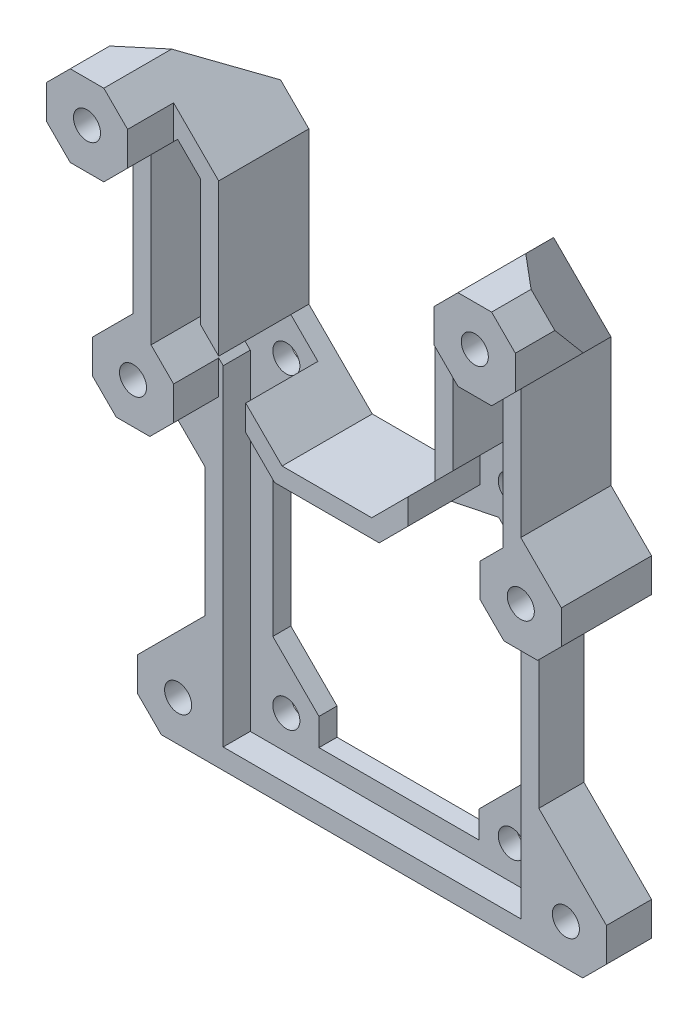
from build123d import *

# Parameters (mm, degrees)
SKETCH5_R           = 1.5
BOSS_EXTRUDE1_DEPTH = 2
SKETCH9_R           = 1.5
BOSS_EXTRUDE3_DEPTH = 3
SKETCH10_R          = 1.5
BOSS_EXTRUDE4_DEPTH = 5
BOSS_EXTRUDE5_DEPTH = 5.1
SKETCH13_R          = 1.5
CUT_EXTRUDE1_DEPTH  = 4.5
CUT_EXTRUDE2_DEPTH  = 7.5
CUT_EXTRUDE3_DEPTH  = 7.5
CHAMFER1_SIZE       = 1
CHAMFER1_SIZE2      = 1.191753593


with BuildPart() as part:
    # Sketch5 → Boss-Extrude1 (new body)
    with BuildSketch(Plane.XY):
        Polygon((19.636038969, -4.5), (-19.636038969, -4.5), (-23.363961031, -4.5), (-26, -1.863961031), (-26, 1.863961031), (-23.363961031, 4.5), (-18.5, 9.363961031), (-18.5, 23.636038969), (-23.363961031, 28.5), (-26, 31.136038969), (-26, 34.863961031), (-23.363961031, 37.5), (-21.5, 39.363961031), (-21.5, 53.636038969), (-23.363961031, 55.5), (-26, 58.136038969), (-26, 61.863961031), (-23.363961031, 64.5), (-19.636038969, 64.5), (-17, 61.863961031), (-12, 56.863961031), (-12, 40.029437252), (-11.050252532, 39.079689783), (-9, 37.029437252), (-4.970562748, 33), (4.970562748, 33), (9, 37.029437252), (11.050252532, 39.079689783), (12, 40.029437252), (12, 56.863961031), (17, 61.863961031), (19.636038969, 64.5), (23.363961031, 64.5), (26, 61.863961031), (26, 58.136038969), (23.363961031, 55.5), (21.5, 53.636038969), (21.5, 39.363961031), (23.363961031, 37.5), (26, 34.863961031), (26, 31.136038969), (23.363961031, 28.5), (18.5, 23.636038969), (18.5, 9.363961031), (23.363961031, 4.5), (26, 1.863961031), (26, -1.863961031), (23.363961031, -4.5), align=None)
        with Locations((-12.5, 35.579689783)):
            Circle(SKETCH5_R, mode=Mode.SUBTRACT)
        with Locations((-12.5, 1.5)):
            Circle(SKETCH5_R, mode=Mode.SUBTRACT)
        with Locations((12.5, 1.5)):
            Circle(SKETCH5_R, mode=Mode.SUBTRACT)
        with Locations((12.5, 35.579689783)):
            Circle(SKETCH5_R, mode=Mode.SUBTRACT)
        Polygon((-5.798989873, 31), (5.798989873, 31), (11.050252532, 32.079689783), (14, 29.129942315), (14, 8.121320344), (11, 5.121320344), (8.878679656, 3), (8.878679656, 0), (-8.878679656, 0), (-8.878679656, 3), (-11, 5.121320344), (-14, 8.121320344), (-14, 29.129942315), (-11.050252532, 32.079689783), align=None, mode=Mode.SUBTRACT)
    extrude(amount=BOSS_EXTRUDE1_DEPTH)

    # Sketch9 → Boss-Extrude3 (add)
    # profile 1 of 2: a face of its own
    with BuildSketch(Plane.XY.offset(2)):
        Polygon((19.636038969, -4.5), (-19.636038969, -4.5), (-23.363961031, -4.5), (-26, -1.863961031), (-26, 1.863961031), (-23.363961031, 4.5), (-18.5, 9.363961031), (-18.5, 23.636038969), (-23.363961031, 28.5), (-26, 31.136038969), (-26, 34.863961031), (-23.363961031, 37.5), (-21.5, 39.363961031), (-21.5, 53.636038969), (-23.363961031, 55.5), (-26, 58.136038969), (-26, 61.863961031), (-23.363961031, 64.5), (-19.636038969, 64.5), (-17, 61.863961031), (-12, 56.863961031), (-12, 40.029437252), (-14, 42.029437252), (-14, 56.035533906), (-16.550252532, 58.585786438), (-17, 58.136038969), (-19.5, 55.636038969), (-19.5, 37.363961031), (-17, 34.863961031), (-16.5, 34.363961031), (-16.5, -2.25), (16.5, -2.25), (16.5, 34.363961031), (17, 34.863961031), (19.5, 37.363961031), (19.5, 55.636038969), (17, 58.136038969), (16.550252532, 58.585786438), (14, 56.035533906), (14, 42.029437252), (12, 40.029437252), (12, 56.863961031), (17, 61.863961031), (19.636038969, 64.5), (23.363961031, 64.5), (26, 61.863961031), (26, 58.136038969), (23.363961031, 55.5), (21.5, 53.636038969), (21.5, 39.363961031), (23.363961031, 37.5), (26, 34.863961031), (26, 31.136038969), (23.363961031, 28.5), (18.5, 23.636038969), (18.5, 9.363961031), (23.363961031, 4.5), (26, 1.863961031), (26, -1.863961031), (23.363961031, -4.5), align=None)
        with Locations((-21.5, 0)):
            Circle(SKETCH9_R, mode=Mode.SUBTRACT)
        with Locations((-21.5, 33)):
            Circle(SKETCH9_R, mode=Mode.SUBTRACT)
        with Locations(Location((21.5, 33, 0), (0, 0, 180))):
            Circle(SKETCH9_R, mode=Mode.SUBTRACT)
        with Locations(Location((21.5, 0, 0), (0, 0, 180))):
            Circle(SKETCH9_R, mode=Mode.SUBTRACT)
    # profile 2 of 2: a face of its own
    with BuildSketch(Plane.XY.offset(2)):
        Polygon((4.970562748, 33), (-4.970562748, 33), (-9, 37.029437252), (-9, 34.201010127), (-5.798989873, 31), (5.798989873, 31), (9, 34.201010127), (9, 37.029437252), align=None)
    extrude(amount=BOSS_EXTRUDE3_DEPTH)

    # Sketch10 → Boss-Extrude4 (add)
    # profile 1 of 3: a face of its own
    with BuildSketch(Plane.XY.offset(5)):
        Polygon((-23.363961031, 28.5), (-19.636038969, 28.5), (-17, 31.136038969), (-17, 34.863961031), (-19.5, 37.363961031), (-19.5, 55.636038969), (-17, 58.136038969), (-16.550252532, 58.585786438), (-14, 56.035533906), (-14, 42.029437252), (-12, 40.029437252), (-12, 56.863961031), (-17, 61.863961031), (-19.636038969, 64.5), (-23.363961031, 64.5), (-26, 61.863961031), (-26, 58.136038969), (-23.363961031, 55.5), (-21.5, 53.636038969), (-21.5, 39.363961031), (-23.363961031, 37.5), (-26, 34.863961031), (-26, 31.136038969), align=None)
        with Locations((-21.5, 33)):
            Circle(SKETCH10_R, mode=Mode.SUBTRACT)
    # profile 2 of 3: a face of its own
    with BuildSketch(Plane.XY.offset(5)):
        Polygon((-9, 34.201010127), (-9, 37.029437252), (-4.970562748, 33), (4.970562748, 33), (9, 37.029437252), (9, 34.201010127), (5.798989873, 31), (-5.798989873, 31), align=None)
    # profile 3 of 3: a face of its own
    with BuildSketch(Plane.XY.offset(5)):
        Polygon((19.636038969, 28.5), (17, 31.136038969), (17, 34.863961031), (19.5, 37.363961031), (19.5, 55.636038969), (17, 58.136038969), (16.550252532, 58.585786438), (14, 56.035533906), (14, 42.029437252), (12, 40.029437252), (12, 56.863961031), (17, 61.863961031), (19.636038969, 64.5), (23.363961031, 64.5), (26, 61.863961031), (26, 58.136038969), (23.363961031, 55.5), (21.5, 53.636038969), (21.5, 39.363961031), (23.363961031, 37.5), (26, 34.863961031), (26, 31.136038969), (23.363961031, 28.5), align=None)
        with Locations(Location((21.5, 33, 0), (0, 0, 180))):
            Circle(SKETCH10_R, mode=Mode.SUBTRACT)
    extrude(amount=BOSS_EXTRUDE4_DEPTH)

    # Sketch12 → Boss-Extrude5 (add)
    with BuildSketch(Plane.XY.offset(10)):
        Polygon((-26, 58.136038969), (-23.363961031, 55.5), (-19.636038969, 55.5), (-17, 58.136038969), (-17, 61.863961031), (-19.636038969, 64.5), (-23.363961031, 64.5), (-26, 61.863961031), align=None)
        Polygon((17, 58.136038969), (17, 61.863961031), (19.636038969, 64.5), (23.363961031, 64.5), (26, 61.863961031), (26, 58.136038969), (23.363961031, 55.5), (19.636038969, 55.5), align=None)
    extrude(amount=BOSS_EXTRUDE5_DEPTH)

    # Sketch13 → Cut-Extrude1 (cut)
    with BuildSketch(Plane.XY.offset(15.1)):
        with Locations((-21.5, 60)):
            Circle(SKETCH13_R)
        with Locations(Location((21.5, 60, 0), (0, 0, 180))):
            Circle(SKETCH13_R)
    extrude(amount=-CUT_EXTRUDE1_DEPTH, mode=Mode.SUBTRACT)

    # Sketch15 → Cut-Extrude2 (cut, symmetric)
    with BuildSketch(Plane(origin=(19.25, 19.25, 0), x_dir=(0, 0, -1), z_dir=(0.7071067811865485, 0.7071067811865467, 0))):
        Polygon((0, 53.129202667), (-15.320888862, 65.98495486), (-8.893012766, 73.645399292), (6.427876097, 60.789647098), align=None)
    extrude(amount=CUT_EXTRUDE2_DEPTH, both=True, mode=Mode.SUBTRACT)

    # Sketch16 → Cut-Extrude3 (cut, symmetric)
    with BuildSketch(Plane(origin=(-19.25, 19.25, 0), x_dir=(0.7071067811865477, 0.7071067811865474, 0), z_dir=(-0.7071067811865474, 0.7071067811865477, 0))):
        Polygon((53.129202667, 0), (65.98495486, -15.320888862), (73.645399292, -8.893012766), (60.789647098, 6.427876097), align=None)
    extrude(amount=CUT_EXTRUDE3_DEPTH, both=True, mode=Mode.SUBTRACT)

    # Chamfer1
    chamfer1_edges = [part.edges().sort_by_distance(p)[0] for p in [
        (18.025126266, 57.110912703, 2),
        (-18.025126266, 57.110912703, 2),
    ]]
    chamfer1_side = [part.faces().sort_by_distance(p)[0] for p in [
        (-13.510979105, 40.518458147, 2),
    ]]
    chamfer(chamfer1_edges, length=CHAMFER1_SIZE, length2=CHAMFER1_SIZE2, reference=chamfer1_side[0])


solid = part.part
